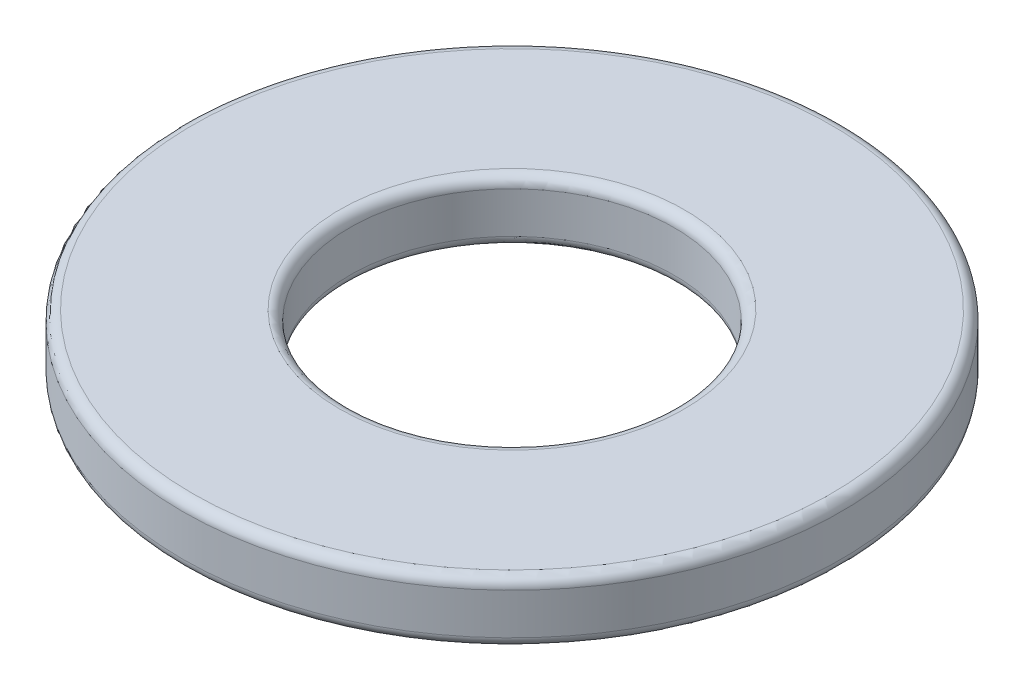
from build123d import *

# Parameters (mm, degrees)
SKETCH2_R           = 16
SKETCH2_R_2         = 7.875
BOSS_EXTRUDE1_DEPTH = 1.5
FILLET1_R           = 0.5


with BuildPart() as part:
    # Sketch2 → Boss-Extrude1 (new, symmetric)
    with BuildSketch(Plane(origin=(0, 0, 0), x_dir=(1, 0, 0), z_dir=(0, 1, 0))):
        with Locations(Location((0, 0, 0), (0, 0, 270))):
            Circle(SKETCH2_R)
        with Locations(Location((0, 0, 0), (0, 0, 270))):
            Circle(SKETCH2_R_2, mode=Mode.SUBTRACT)
    extrude(amount=BOSS_EXTRUDE1_DEPTH, both=True)

    # Fillet1
    fillet1_edges = [part.edges().sort_by_distance(p)[0] for p in [
        (0, -1.5, -16),
        (0, 1.5, -16),
        (0, -1.5, -7.875),
        (0, 1.5, -7.875),
    ]]
    fillet(fillet1_edges, radius=FILLET1_R)


solid = part.part
